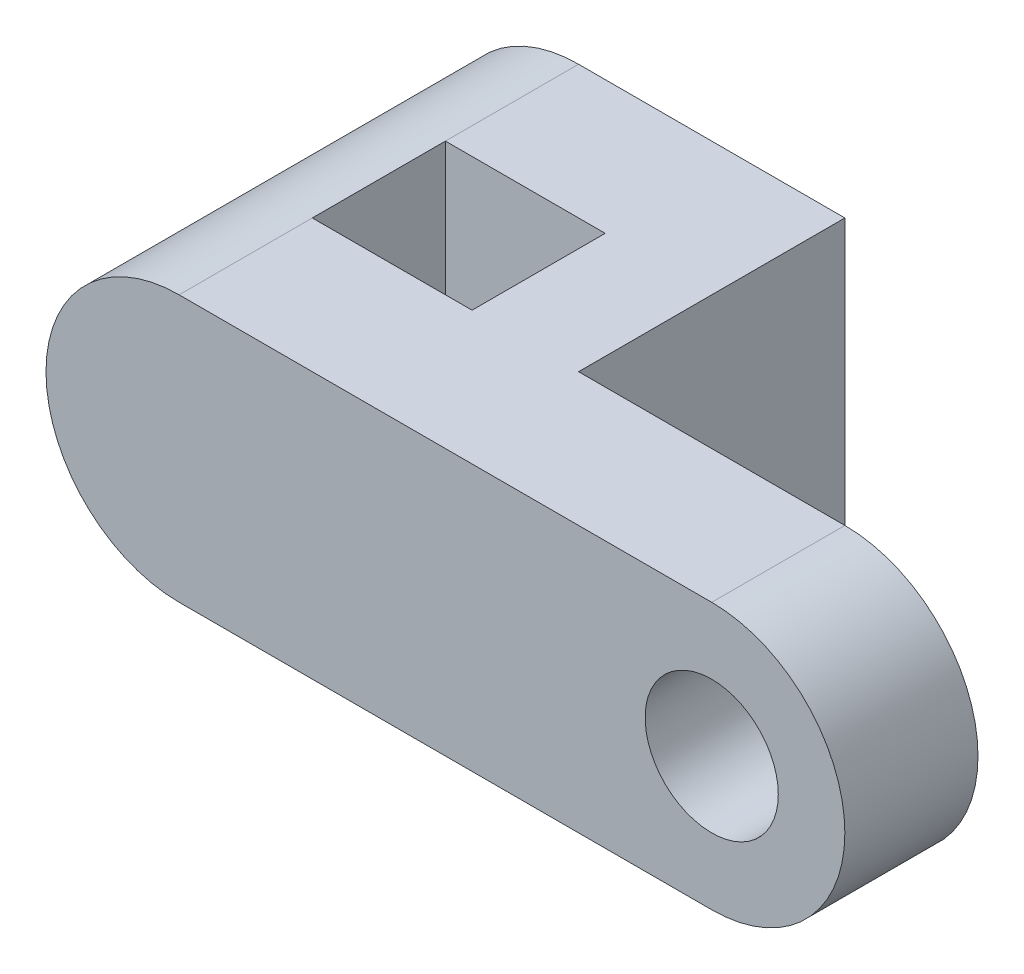
from build123d import *

# Parameters (mm, degrees)
SKETCH2_R                = 2.5
BOSS_EXTRUDE1_DEPTH      = 5
BOSS_EXTRUDE2_DEPTH      = 10
BOSS_EXTRUDE2_DEPTH_BACK = 5
SKETCH4_W                = 6
SKETCH4_H                = 5
CUT_EXTRUDE1_DEPTH       = 10


with BuildPart() as part:
    # Sketch2 → Boss-Extrude1 (new body)
    with BuildSketch(Plane.XY):
        with BuildLine():
            Line((0, 5), (20, 5))
            ThreePointArc((20, 5), (25, 0), (20, -5))
            Line((20, -5), (0, -5))
            ThreePointArc((0, -5), (-5, 0), (0, 5))
        make_face()
        with Locations((20, 0)):
            Circle(SKETCH2_R, mode=Mode.SUBTRACT)
    extrude(amount=BOSS_EXTRUDE1_DEPTH)

    # Sketch3 → Boss-Extrude2 (add, two sides: drawn at the far end of the back side and taken through both)
    with BuildSketch(Plane(origin=(0, 0, 0), x_dir=(-1, 0, 0), z_dir=(0, 0, -1)).offset(-BOSS_EXTRUDE2_DEPTH_BACK)):
        with BuildLine():
            Line((-10, 5), (0, 5))
            ThreePointArc((0, 5), (5, 0), (0, -5))
            Line((0, -5), (-10, -5))
            Line((-10, -5), (-10, 5))
        make_face()
    extrude(amount=BOSS_EXTRUDE2_DEPTH + BOSS_EXTRUDE2_DEPTH_BACK)

    # Sketch4 → Cut-Extrude1 (cut)
    with BuildSketch(Plane(origin=(0, 5, 0), x_dir=(1, 0, 0), z_dir=(0, 1, 0))):
        with Locations((3, 2.5)):
            Rectangle(SKETCH4_W, SKETCH4_H)
    extrude(amount=-CUT_EXTRUDE1_DEPTH, mode=Mode.SUBTRACT)


solid = part.part
